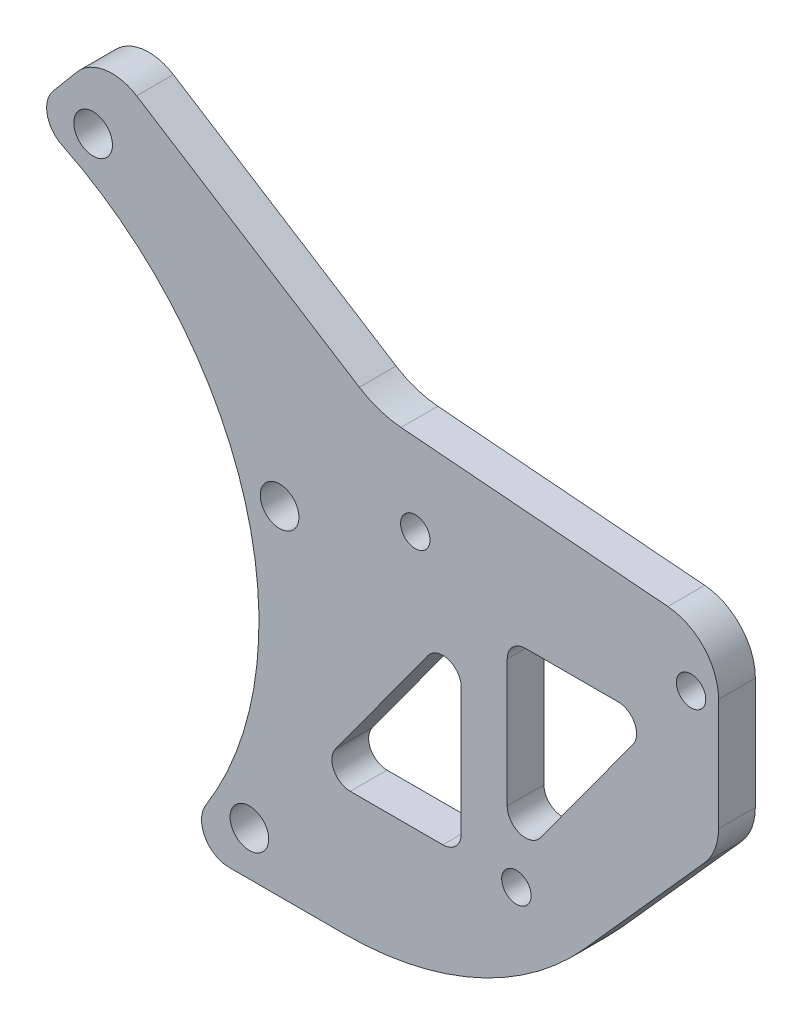
from build123d import *

# Parameters (mm, degrees)
SKETCH_3_R          = 2.1
EXTRUDE_2_DEPTH     = 4
FILLET_1_R          = 5
FILLET_3_R          = 6
FILLET_4_R          = 10
FILLET_5_R          = 35
CUT_EXTRUDE_START   = -4
SKETCH_4_R          = 1.6
SKETCH_4_R_2        = 2.1
CUT_EXTRUDE_1_DEPTH = 4
SKETCH_5_R          = 1.6
CUT_EXTRUDE_2_DEPTH = 4
FILLET_7_R          = 2
FILLET_8_R          = 2
FILLET_9_R          = 3
SKETCH_7_R          = 1.6
CUT_EXTRUDE_3_DEPTH = 10


with BuildPart() as part:
    # 草图3 → 凸台-拉伸2 (new body)
    with BuildSketch(Plane.XY):
        with BuildLine():
            Line((20.996765446, 45.242348331), (12.996765446, 35.70831959))
            ThreePointArc((12.996765446, 35.70831959), (31.127777683, 21.795904581), (38, 0))
            ThreePointArc((38, 0), (35.633322615, -13.20099691), (28.828088452, -24.757651669))
            Line((28.828088452, -24.757651669), (62.996765446, -24.757651669))
            Line((62.996765446, -24.757651669), (87.996765446, 3.242348331))
            Line((87.996765446, 3.242348331), (87.996765446, 23.242348331))
            Line((87.996765446, 23.242348331), (50.996765446, 26.242348331))
            Line((50.996765446, 26.242348331), (20.996765446, 45.242348331))
        make_face()
        with Locations((36.955694518, -19.956869561)):
            Circle(SKETCH_3_R, mode=Mode.SUBTRACT)
        with Locations((19.956869561, 36.955694518)):
            Circle(SKETCH_3_R, mode=Mode.SUBTRACT)
        with Locations((40.243259995, 12.019984399)):
            Circle(SKETCH_3_R, mode=Mode.SUBTRACT)
    extrude(amount=EXTRUDE_2_DEPTH)

    # 圆角1
    fillet_1_edges = [part.edges().sort_by_distance(p)[0] for p in [
        (20.996765446, 45.242348331, 2),
    ]]
    fillet(fillet_1_edges, radius=FILLET_1_R)

    # 圆角3
    fillet_3_edges = [part.edges().sort_by_distance(p)[0] for p in [
        (87.996765446, 23.242348331, 2),
        (87.996765446, 3.242348331, 2),
    ]]
    fillet(fillet_3_edges, radius=FILLET_3_R)

    # 圆角4
    fillet_4_edges = [part.edges().sort_by_distance(p)[0] for p in [
        (50.996765446, 26.242348331, 2),
    ]]
    fillet(fillet_4_edges, radius=FILLET_4_R)

    # 圆角5
    fillet_5_edges = [part.edges().sort_by_distance(p)[0] for p in [
        (62.996765446, -24.757651669, 2),
    ]]
    fillet(fillet_5_edges, radius=FILLET_5_R)

    # 草图4 → 切除-拉伸1 (cut)
    with BuildSketch(Plane.XY.offset(4).offset(CUT_EXTRUDE_START)):
        with Locations((55.003259995, 16.999984399)):
            Circle(SKETCH_4_R)
        with Locations((40.243259995, 12.019984399)):
            Circle(SKETCH_4_R_2)
        with Locations((85.003259995, 16.999984399)):
            Circle(SKETCH_4_R)
    extrude(amount=CUT_EXTRUDE_1_DEPTH, mode=Mode.SUBTRACT)

    # 草图5 → 切除-拉伸2 (cut)
    with BuildSketch(Plane.XY.offset(4).offset(CUT_EXTRUDE_START)):
        with Locations((55.003259995, 16.999984399)):
            Circle(SKETCH_5_R)
        Polygon((65.003259995, 11.999984399), (81.003259995, 11.999984399), (65.003259995, -10.000015601), align=None)
        Polygon((60.003259995, 10.999984399), (60.003259995, -11.000015601), (44.003259995, -11.000015601), align=None)
    extrude(amount=CUT_EXTRUDE_2_DEPTH, mode=Mode.SUBTRACT)

    # 圆角7
    fillet_7_edges = [part.edges().sort_by_distance(p)[0] for p in [
        (65.003259995, 11.999984399, 2),
        (60.003259995, -11.000015601, 2),
    ]]
    fillet(fillet_7_edges, radius=FILLET_7_R)

    # 圆角8
    fillet_8_edges = [part.edges().sort_by_distance(p)[0] for p in [
        (65.003259995, -10.000015601, 2),
        (81.003259995, 11.999984399, 2),
        (44.003259995, -11.000015601, 2),
        (60.003259995, 10.999984399, 2),
    ]]
    fillet(fillet_8_edges, radius=FILLET_8_R)

    # 圆角9
    fillet_9_edges = [part.edges().sort_by_distance(p)[0] for p in [
        (12.996765446, 35.70831959, 2),
        (28.828088452, -24.757651669, 2),
    ]]
    fillet(fillet_9_edges, radius=FILLET_9_R)

    # 草图7 → 切除-拉伸3 (cut)
    with BuildSketch(Plane.XY.offset(4)):
        with Locations((66.003259995, -11.000015601)):
            Circle(SKETCH_7_R)
    extrude(amount=-CUT_EXTRUDE_3_DEPTH, mode=Mode.SUBTRACT)


solid = part.part
